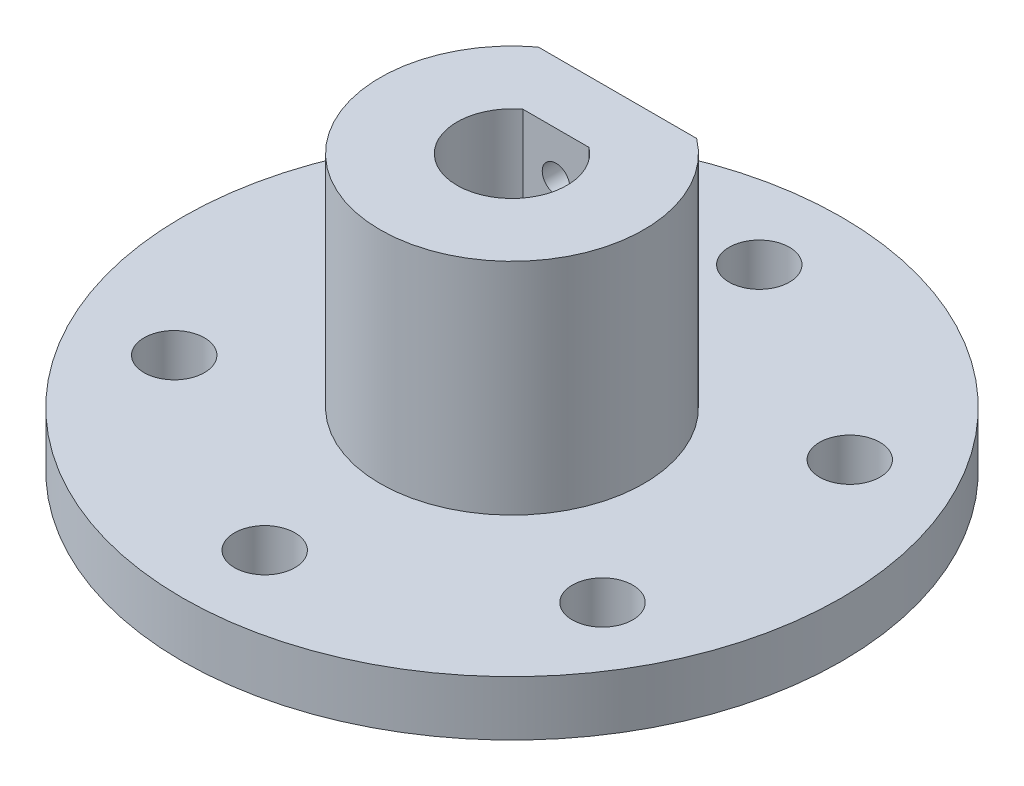
from build123d import *

# Parameters (mm, degrees)
SKETCH_1_R             = 30
SKETCH_1_R_2           = 2.75
SKETCH_1_R_3           = 2.51
EXTRUDE_1_DEPTH        = 5
EXTRUDE_2_DEPTH        = 20
HOLE_WIZARD_M3_1_D     = 2.5
HOLE_WIZARD_M3_1_DEPTH = 5.6
CUT_EXTRUDE_1_REACH    = 57.616
SKETCH_5_R             = 1.6


with BuildPart() as part:
    # 草图1 → 凸台-拉伸1 (new body)
    with BuildSketch(Plane(origin=(0, 0, 0), x_dir=(1, 0, 0), z_dir=(0, 1, 0))):
        with Locations(Location((0, 0, 0), (0, 0, 270))):
            Circle(SKETCH_1_R)
        with Locations(Location((0, 22.5, 0), (0, 0, 270))):
            Circle(SKETCH_1_R_2, mode=Mode.SUBTRACT)
        with Locations(Location((19.485571585, 11.25, 0), (0, 0, 270))):
            Circle(SKETCH_1_R_2, mode=Mode.SUBTRACT)
        with Locations(Location((19.485571585, -11.25, 0), (0, 0, 270))):
            Circle(SKETCH_1_R_2, mode=Mode.SUBTRACT)
        with Locations(Location((0, -22.5, 0), (0, 0, 270))):
            Circle(SKETCH_1_R_2, mode=Mode.SUBTRACT)
        with Locations(Location((-19.485571585, -11.25, 0), (0, 0, 270))):
            Circle(SKETCH_1_R_2, mode=Mode.SUBTRACT)
        with Locations(Location((-19.485571585, 11.25, 0), (0, 0, 270))):
            Circle(SKETCH_1_R_2, mode=Mode.SUBTRACT)
        with Locations(Location((0, 0, 0), (0, 0, 270))):
            Circle(SKETCH_1_R_3, mode=Mode.SUBTRACT)
    extrude(amount=EXTRUDE_1_DEPTH)

    # 草图2 → 凸台-拉伸2 (add)
    with BuildSketch(Plane(origin=(0, 5, 0), x_dir=(1, 0, 0), z_dir=(0, 1, 0))):
        with BuildLine():
            Line((-7.2, 9.6), (7.2, 9.6))
            ThreePointArc((7.2, 9.6), (0, -12), (-7.2, 9.6))
        make_face()
        with BuildLine():
            Line((3, 4), (-3, 4))
            ThreePointArc((-3, 4), (0, -5), (3, 4))
        make_face(mode=Mode.SUBTRACT)
    extrude(amount=EXTRUDE_2_DEPTH)

    # M3 螺纹孔1
    with Locations(Plane(origin=(0, 0, -9.6), x_dir=(-1, 0, 0), z_dir=(0, 0, -1))):
        with Locations((0, 21)):
            Hole(HOLE_WIZARD_M3_1_D / 2, depth=HOLE_WIZARD_M3_1_DEPTH)

    # 草图5 → 切除-拉伸1 (cut, up to next)
    with BuildSketch(Plane(origin=(0, 0, -9.6), x_dir=(-1, 0, 0), z_dir=(0, 0, -1)), mode=Mode.PRIVATE) as cut_extrude_1_sk1:
        with Locations((0, 15)):
            Circle(SKETCH_5_R)
    cut_extrude_1_tool1 = extrude(cut_extrude_1_sk1.sketch, amount=-CUT_EXTRUDE_1_REACH, mode=Mode.PRIVATE) & part.part
    add(cut_extrude_1_tool1.solids().sort_by_distance((0, 15, -9.6))[0], mode=Mode.SUBTRACT)


solid = part.part
